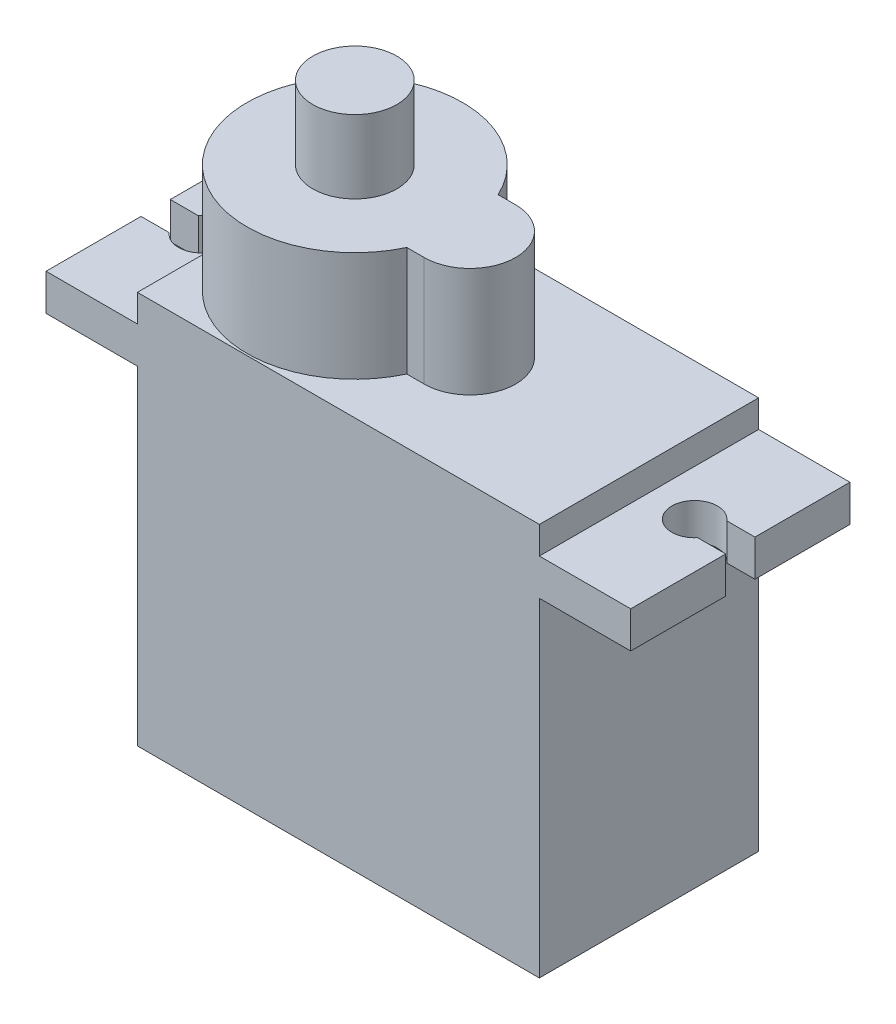
from build123d import *

# Parameters (mm, degrees)
EXTRUDE_1_DEPTH     = 12
SKETCH_2_R          = 2.3
EXTRUDE_2_DEPTH     = 6
SKETCH_3_R          = 2.3
EXTRUDE_3_DEPTH     = 10
CUT_EXTRUDE_1_REACH = 37.679


with BuildPart() as part:
    # 草图1 → 凸台-拉伸1 (new body)
    with BuildSketch(Plane.XY):
        Polygon((0, 0), (22, 0), (22, 18), (27, 18), (27, 20), (22, 20), (22, 21.5), (0, 21.5), (0, 20), (-5, 20), (-5, 18), (0, 18), align=None)
    extrude(amount=EXTRUDE_1_DEPTH)

    # 草图2 → 凸台-拉伸2 (add)
    with BuildSketch(Plane(origin=(0, 21.5, 0), x_dir=(1, 0, 0), z_dir=(0, 1, 0))):
        with BuildLine():
            Line((12.2, -3.5), (11.244155686, -3.5))
            ThreePointArc((11.244155686, -3.5), (0, -6), (11.244155686, -8.5))
            Line((11.244155686, -8.5), (12.2, -8.5))
            ThreePointArc((12.2, -8.5), (14.7, -6), (12.2, -3.5))
        make_face()
        with Locations(Location((5.9, -6, 0), (0, 0, 270))):
            Circle(SKETCH_2_R, mode=Mode.SUBTRACT)
    extrude(amount=EXTRUDE_2_DEPTH)

    # 草图3 → 凸台-拉伸3 (add)
    with BuildSketch(Plane(origin=(0, 21.5, 0), x_dir=(1, 0, 0), z_dir=(0, 1, 0))):
        with Locations(Location((5.9, -6, 0), (0, 0, 270))):
            Circle(SKETCH_3_R)
    extrude(amount=EXTRUDE_3_DEPTH)

    # 草图4 → 切除-拉伸1 (cut, up to next)
    with BuildSketch(Plane(origin=(0, 20, 0), x_dir=(1, 0, 0), z_dir=(0, 1, 0)), mode=Mode.PRIVATE) as cut_extrude_1_sk1:
        with BuildLine():
            Line((27, -5.2), (27, -6.8))
            Line((27, -6.8), (25.460468636, -6.8))
            ThreePointArc((25.460468636, -6.8), (23.25, -6), (25.460468636, -5.2))
            Line((25.460468636, -5.2), (27, -5.2))
        make_face()
    cut_extrude_1_tool1 = extrude(cut_extrude_1_sk1.sketch, amount=-CUT_EXTRUDE_1_REACH, mode=Mode.PRIVATE) & part.part
    # 草图4 → 切除-拉伸1 (cut, up to next)
    with BuildSketch(Plane(origin=(0, 20, 0), x_dir=(1, 0, 0), z_dir=(0, 1, 0)), mode=Mode.PRIVATE) as cut_extrude_1_sk2:
        with BuildLine():
            Line((-5, -5.2), (-5, -6.8))
            Line((-5, -6.8), (-3.460468636, -6.8))
            ThreePointArc((-3.460468636, -6.8), (-1.25, -6), (-3.460468636, -5.2))
            Line((-3.460468636, -5.2), (-5, -5.2))
        make_face()
    cut_extrude_1_tool2 = extrude(cut_extrude_1_sk2.sketch, amount=-CUT_EXTRUDE_1_REACH, mode=Mode.PRIVATE) & part.part
    add(cut_extrude_1_tool1.solids().sort_by_distance((25.055712, 20, 6))[0], mode=Mode.SUBTRACT)
    add(cut_extrude_1_tool2.solids().sort_by_distance((-3.055712, 20, 6))[0], mode=Mode.SUBTRACT)


solid = part.part
